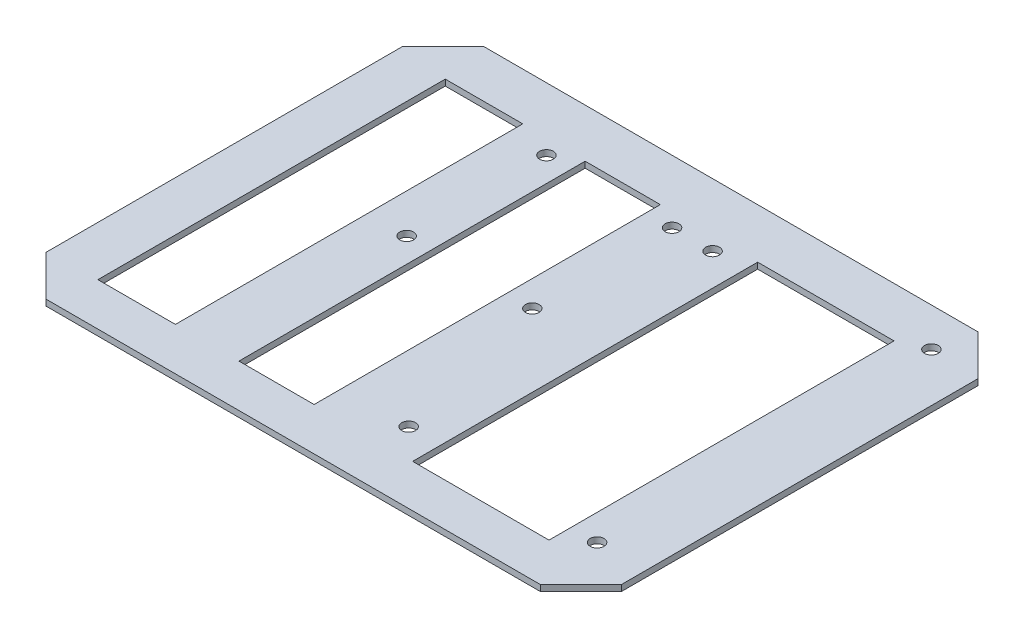
from build123d import *

# Parameters (mm, degrees)
SKETCH1_W           = 142
SKETCH1_H           = 108
BOSS_EXTRUDE1_DEPTH = 1.5
CHAMFER1_SIZE       = 10
CUT_EXTRUDE1_REACH  = 91.215
SKETCH2_R           = 1.7
CUT_EXTRUDE2_REACH  = 91.215
SKETCH3_R           = 1.7
CUT_EXTRUDE3_REACH  = 91.215
SKETCH4_W           = 19.130277945
SKETCH4_H           = 85.726659062
SKETCH4_W_2         = 33.657782249
SKETCH4_H_2         = 85.151312357
SKETCH4_W_3         = 18.55493124
SKETCH4_H_3         = 85.438985709


with BuildPart() as part:
    # Sketch1 → Boss-Extrude1 (new body)
    with BuildSketch(Plane(origin=(0, 0, 0), x_dir=(1, 0, 0), z_dir=(0, 1, 0))):
        Rectangle(SKETCH1_W, SKETCH1_H)
    extrude(amount=BOSS_EXTRUDE1_DEPTH)

    # Chamfer1
    chamfer1_edges = [part.edges().sort_by_distance(p)[0] for p in [
        (71, 0.75, 54),
        (-71, 0.75, 54),
        (-71, 0.75, -54),
        (71, 0.75, -54),
    ]]
    chamfer(chamfer1_edges, length=CHAMFER1_SIZE)

    # Sketch2 → Cut-Extrude1 (cut, up to next)
    with BuildSketch(Plane(origin=(0, 1.5, 0), x_dir=(1, 0, 0), z_dir=(0, 1, 0)), mode=Mode.PRIVATE) as cut_extrude1_sk1:
        with Locations(Location((59, 44.5, 0), (0, 0, 270))):
            Circle(SKETCH2_R)
    cut_extrude1_tool1 = extrude(cut_extrude1_sk1.sketch, amount=-CUT_EXTRUDE1_REACH, mode=Mode.PRIVATE) & part.part
    # Sketch2 → Cut-Extrude1 (cut, up to next)
    with BuildSketch(Plane(origin=(0, 1.5, 0), x_dir=(1, 0, 0), z_dir=(0, 1, 0)), mode=Mode.PRIVATE) as cut_extrude1_sk2:
        with Locations(Location((11, 38.5, 0), (0, 0, 270))):
            Circle(SKETCH2_R)
    cut_extrude1_tool2 = extrude(cut_extrude1_sk2.sketch, amount=-CUT_EXTRUDE1_REACH, mode=Mode.PRIVATE) & part.part
    # Sketch2 → Cut-Extrude1 (cut, up to next)
    with BuildSketch(Plane(origin=(0, 1.5, 0), x_dir=(1, 0, 0), z_dir=(0, 1, 0)), mode=Mode.PRIVATE) as cut_extrude1_sk3:
        with Locations(Location((11, -36.5, 0), (0, 0, 270))):
            Circle(SKETCH2_R)
    cut_extrude1_tool3 = extrude(cut_extrude1_sk3.sketch, amount=-CUT_EXTRUDE1_REACH, mode=Mode.PRIVATE) & part.part
    # Sketch2 → Cut-Extrude1 (cut, up to next)
    with BuildSketch(Plane(origin=(0, 1.5, 0), x_dir=(1, 0, 0), z_dir=(0, 1, 0)), mode=Mode.PRIVATE) as cut_extrude1_sk4:
        with Locations(Location((59, -38, 0), (0, 0, 270))):
            Circle(SKETCH2_R)
    cut_extrude1_tool4 = extrude(cut_extrude1_sk4.sketch, amount=-CUT_EXTRUDE1_REACH, mode=Mode.PRIVATE) & part.part
    add(cut_extrude1_tool1.solids().sort_by_distance((59, 1.5, -44.5))[0], mode=Mode.SUBTRACT)
    add(cut_extrude1_tool2.solids().sort_by_distance((11, 1.5, -38.5))[0], mode=Mode.SUBTRACT)
    add(cut_extrude1_tool3.solids().sort_by_distance((11, 1.5, 36.5))[0], mode=Mode.SUBTRACT)
    add(cut_extrude1_tool4.solids().sort_by_distance((59, 1.5, 38))[0], mode=Mode.SUBTRACT)

    # Sketch3 → Cut-Extrude2 (cut, up to next)
    with BuildSketch(Plane(origin=(0, 1.5, 0), x_dir=(1, 0, 0), z_dir=(0, 1, 0)), mode=Mode.PRIVATE) as cut_extrude2_sk1:
        with Locations(Location((-30, 38.5, 0), (0, 0, 270))):
            Circle(SKETCH3_R)
    cut_extrude2_tool1 = extrude(cut_extrude2_sk1.sketch, amount=-CUT_EXTRUDE2_REACH, mode=Mode.PRIVATE) & part.part
    # Sketch3 → Cut-Extrude2 (cut, up to next)
    with BuildSketch(Plane(origin=(0, 1.5, 0), x_dir=(1, 0, 0), z_dir=(0, 1, 0)), mode=Mode.PRIVATE) as cut_extrude2_sk2:
        with Locations(Location((1, 38.5, 0), (0, 0, 270))):
            Circle(SKETCH3_R)
    cut_extrude2_tool2 = extrude(cut_extrude2_sk2.sketch, amount=-CUT_EXTRUDE2_REACH, mode=Mode.PRIVATE) & part.part
    # Sketch3 → Cut-Extrude2 (cut, up to next)
    with BuildSketch(Plane(origin=(0, 1.5, 0), x_dir=(1, 0, 0), z_dir=(0, 1, 0)), mode=Mode.PRIVATE) as cut_extrude2_sk3:
        with Locations(Location((1, 4, 0), (0, 0, 270))):
            Circle(SKETCH3_R)
    cut_extrude2_tool3 = extrude(cut_extrude2_sk3.sketch, amount=-CUT_EXTRUDE2_REACH, mode=Mode.PRIVATE) & part.part
    # Sketch3 → Cut-Extrude2 (cut, up to next)
    with BuildSketch(Plane(origin=(0, 1.5, 0), x_dir=(1, 0, 0), z_dir=(0, 1, 0)), mode=Mode.PRIVATE) as cut_extrude2_sk4:
        with Locations(Location((-30, 4, 0), (0, 0, 270))):
            Circle(SKETCH3_R)
    cut_extrude2_tool4 = extrude(cut_extrude2_sk4.sketch, amount=-CUT_EXTRUDE2_REACH, mode=Mode.PRIVATE) & part.part
    add(cut_extrude2_tool1.solids().sort_by_distance((-30, 1.5, -38.5))[0], mode=Mode.SUBTRACT)
    add(cut_extrude2_tool2.solids().sort_by_distance((1, 1.5, -38.5))[0], mode=Mode.SUBTRACT)
    add(cut_extrude2_tool3.solids().sort_by_distance((1, 1.5, -4))[0], mode=Mode.SUBTRACT)
    add(cut_extrude2_tool4.solids().sort_by_distance((-30, 1.5, -4))[0], mode=Mode.SUBTRACT)

    # Sketch4 → Cut-Extrude3 (cut, up to next)
    with BuildSketch(Plane(origin=(0, 1.5, 0), x_dir=(1, 0, 0), z_dir=(0, 1, 0)), mode=Mode.PRIVATE) as cut_extrude3_sk1:
        with Locations((-49.192143288, -0.575346705)):
            Rectangle(SKETCH4_W, SKETCH4_H)
    cut_extrude3_tool1 = extrude(cut_extrude3_sk1.sketch, amount=-CUT_EXTRUDE3_REACH, mode=Mode.PRIVATE) & part.part
    # Sketch4 → Cut-Extrude3 (cut, up to next)
    with BuildSketch(Plane(origin=(0, 1.5, 0), x_dir=(1, 0, 0), z_dir=(0, 1, 0)), mode=Mode.PRIVATE) as cut_extrude3_sk2:
        with Locations((35.743414055, -0.863020057)):
            Rectangle(SKETCH4_W_2, SKETCH4_H_2)
    cut_extrude3_tool2 = extrude(cut_extrude3_sk2.sketch, amount=-CUT_EXTRUDE3_REACH, mode=Mode.PRIVATE) & part.part
    # Sketch4 → Cut-Extrude3 (cut, up to next)
    with BuildSketch(Plane(origin=(0, 1.5, 0), x_dir=(1, 0, 0), z_dir=(0, 1, 0)), mode=Mode.PRIVATE) as cut_extrude3_sk3:
        with Locations((-14.67134098, -0.719183381)):
            Rectangle(SKETCH4_W_3, SKETCH4_H_3)
    cut_extrude3_tool3 = extrude(cut_extrude3_sk3.sketch, amount=-CUT_EXTRUDE3_REACH, mode=Mode.PRIVATE) & part.part
    add(cut_extrude3_tool1.solids().sort_by_distance((-49.192143, 1.5, 0.575347))[0], mode=Mode.SUBTRACT)
    add(cut_extrude3_tool2.solids().sort_by_distance((35.743414, 1.5, 0.86302))[0], mode=Mode.SUBTRACT)
    add(cut_extrude3_tool3.solids().sort_by_distance((-14.671341, 1.5, 0.719183))[0], mode=Mode.SUBTRACT)


solid = part.part
